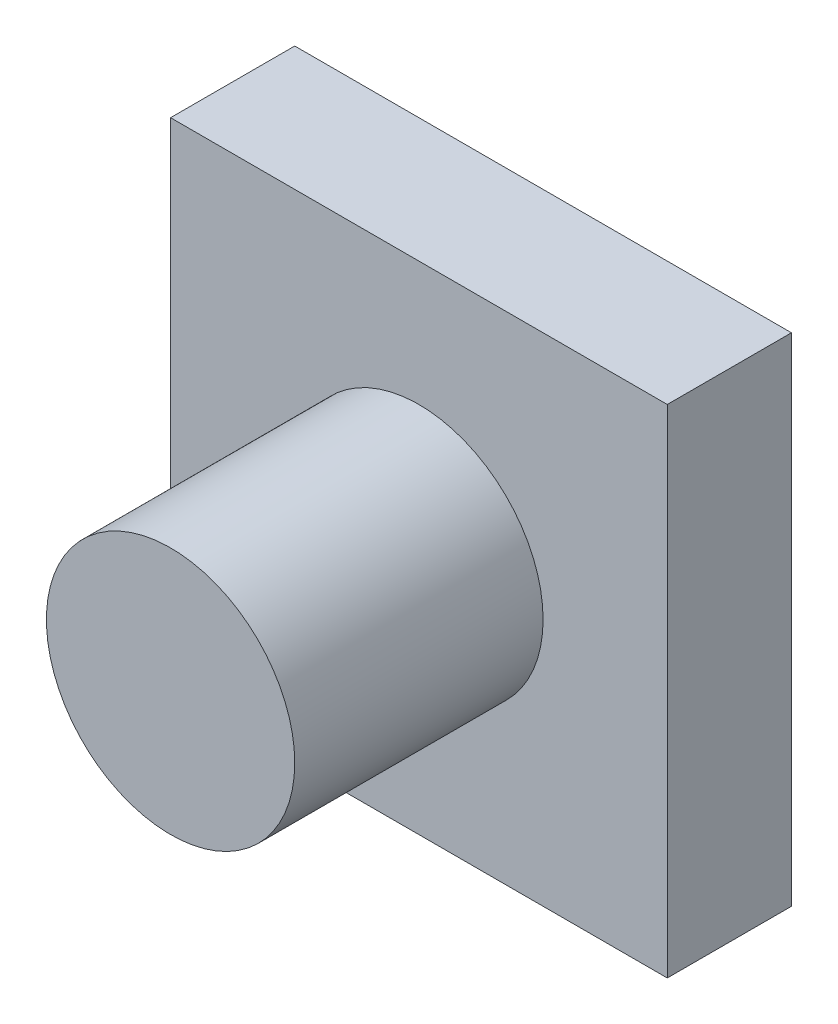
from build123d import *

# Parameters (mm, degrees)
SKETCH1_W           = 40
SKETCH1_H           = 40
BOSS_EXTRUDE1_DEPTH = 10
SKETCH3_R           = 10
BOSS_EXTRUDE2_DEPTH = 20


with BuildPart() as part:
    # Sketch1 → Boss-Extrude1 (new body)
    with BuildSketch(Plane.XY):
        with Locations((6.710963455, -4.784053156)):
            Rectangle(SKETCH1_W, SKETCH1_H)
    extrude(amount=BOSS_EXTRUDE1_DEPTH)

    # Sketch3 → Boss-Extrude2 (add)
    with BuildSketch(Plane.XY.offset(10)):
        with Locations((6.710963455, -4.784053156)):
            Circle(SKETCH3_R)
    extrude(amount=BOSS_EXTRUDE2_DEPTH)


solid = part.part
